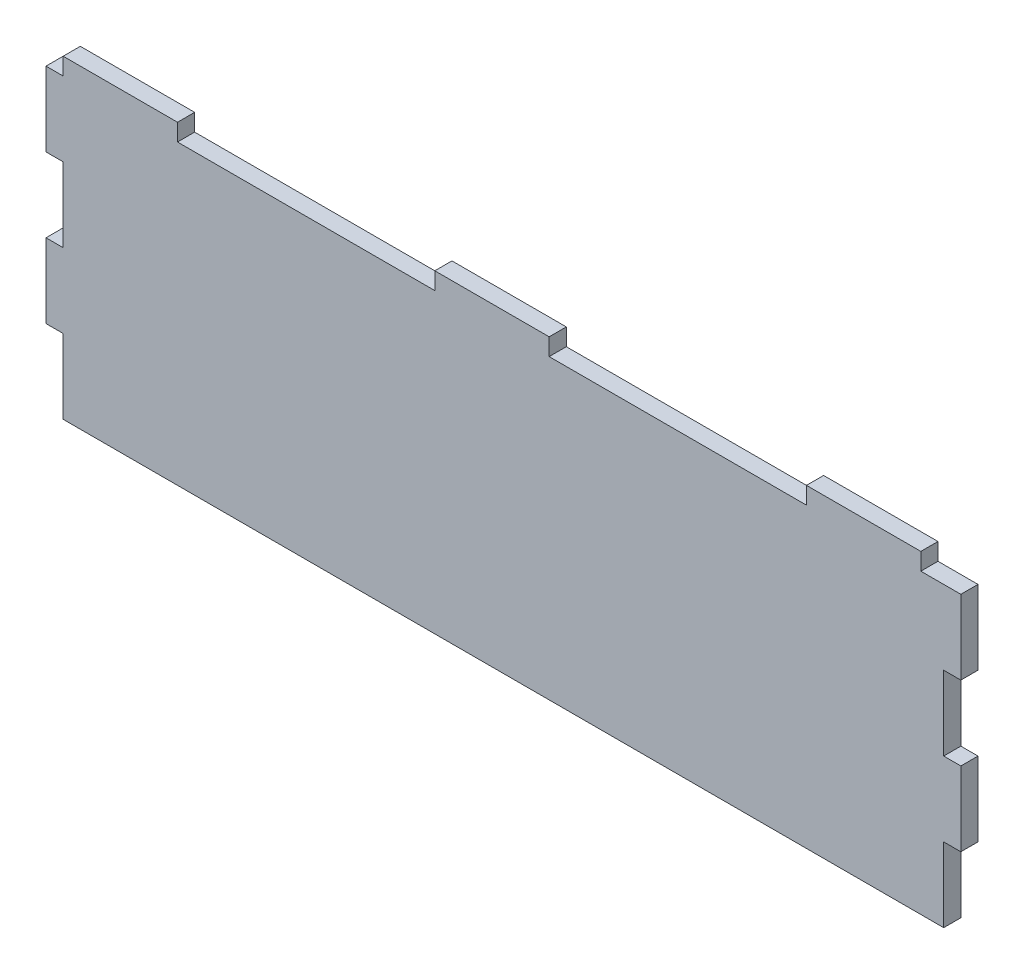
from build123d import *

# Parameters (mm, degrees)
BOSS_EXTRUDE1_DEPTH = 3


with BuildPart() as part:
    # Sketch1 → Boss-Extrude1 (new body)
    with BuildSketch(Plane.XY):
        Polygon((-57, 24.5), (-12, 24.5), (-12, 27.5), (8, 27.5), (8, 24.5), (53, 24.5), (53, 27.5), (73, 27.5), (73, 24.5), (80, 24.5), (80, 11.5), (77, 11.5), (77, -1.5), (80, -1.5), (80, -14.5), (77, -14.5), (77, -27.5), (-77, -27.5), (-77, -14.5), (-80, -14.5), (-80, -1.5), (-77, -1.5), (-77, 11.5), (-80, 11.5), (-80, 24.5), (-77, 24.5), (-77, 27.5), (-57, 27.5), align=None)
    extrude(amount=BOSS_EXTRUDE1_DEPTH)


solid = part.part
